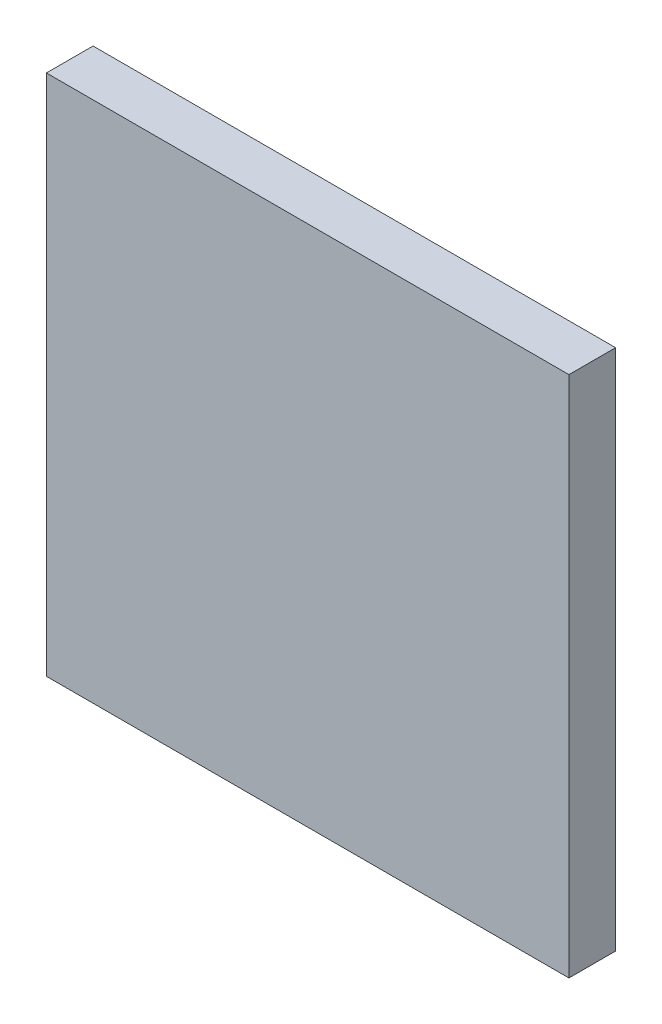
from build123d import *

# Parameters (mm, degrees)
SKETCH1_W           = 56
SKETCH1_H           = 56
BOSS_EXTRUDE1_DEPTH = 2
SKETCH1_3_W         = 56
SKETCH1_3_H         = 56
SKETCH1_3_W_2       = 53
SKETCH1_3_H_2       = 53
BOSS_EXTRUDE2_DEPTH = 3


with BuildPart() as part:
    # Sketch1 → Boss-Extrude1 (new body)
    with BuildSketch(Plane.XY):
        Rectangle(SKETCH1_W, SKETCH1_H)
    extrude(amount=BOSS_EXTRUDE1_DEPTH)

    # Sketch1<3> → Boss-Extrude2 (add)
    with BuildSketch(Plane.XY):
        Rectangle(SKETCH1_3_W, SKETCH1_3_H)
        Rectangle(SKETCH1_3_W_2, SKETCH1_3_H_2, mode=Mode.SUBTRACT)
    extrude(amount=-BOSS_EXTRUDE2_DEPTH)


solid = part.part
